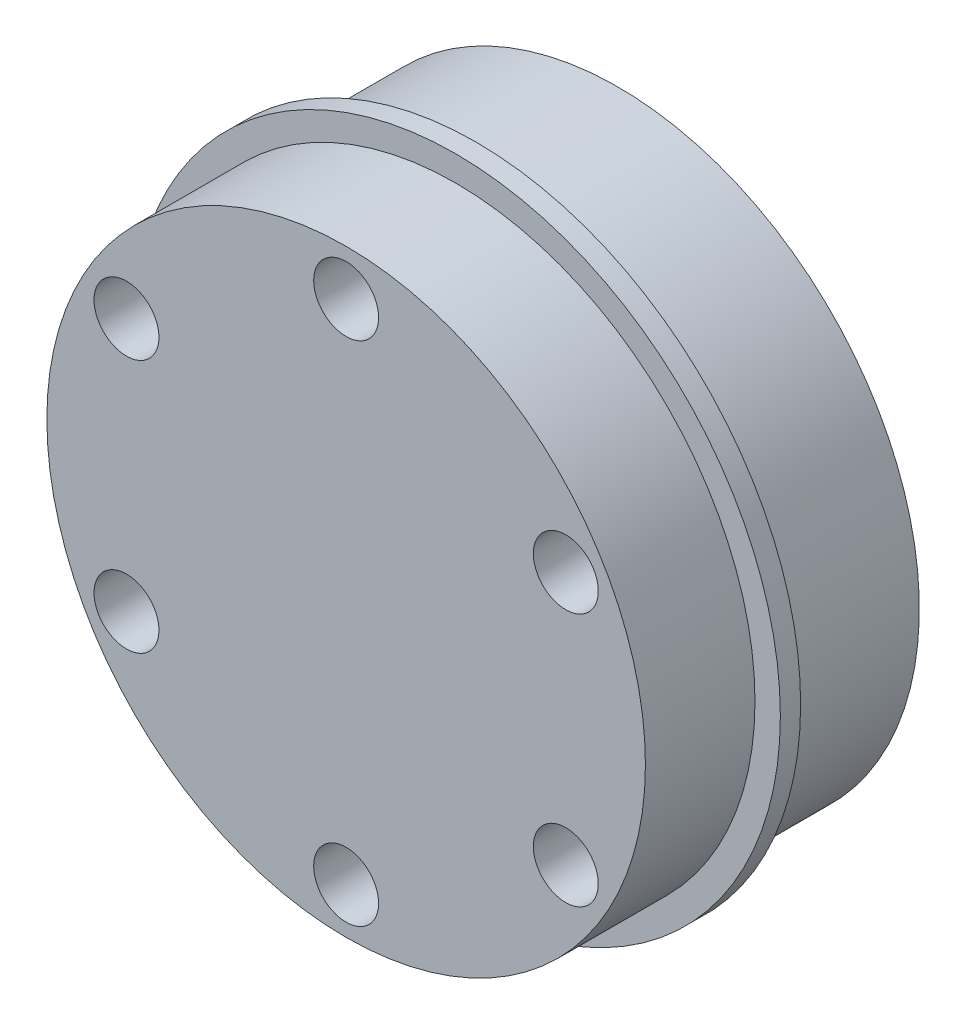
from build123d import *

# Parameters (mm, degrees)
SKETCH_1_R          = 14.75
EXTRUDE_1_DEPTH     = 5.4
SKETCH_3_R          = 16
EXTRUDE_2_DEPTH     = 1
SKETCH_4_R          = 14.85
EXTRUDE_3_DEPTH     = 7
SKETCH_2_R          = 1.6
CUT_EXTRUDE_2_DEPTH = 27.297528401


with BuildPart() as part:
    # 草图1 → 凸台-拉伸1 (new body)
    with BuildSketch(Plane.XY):
        with Locations(Location((0, 0, 0), (0, 0, 180))):
            Circle(SKETCH_1_R)
    extrude(amount=EXTRUDE_1_DEPTH)

    # 草图3 → 凸台-拉伸2 (add)
    with BuildSketch(Plane(origin=(0, 0, 0), x_dir=(-1, 0, 0), z_dir=(0, 0, -1))):
        Circle(SKETCH_3_R)
    extrude(amount=EXTRUDE_2_DEPTH)

    # 草图4 → 凸台-拉伸3 (add)
    with BuildSketch(Plane(origin=(0, 0, -1), x_dir=(-1, 0, 0), z_dir=(0, 0, -1))):
        Circle(SKETCH_4_R)
    extrude(amount=EXTRUDE_3_DEPTH)

    # 草图2 → 切除-拉伸2 (cut, through all)
    with BuildSketch(Plane(origin=(0, 0, 5.4), x_dir=(-1, 0, 0), z_dir=(0, 0, -1))):
        with Locations((10.825317547, -6.25)):
            Circle(SKETCH_2_R)
        with Locations((-10.825317547, 6.25)):
            Circle(SKETCH_2_R)
        with Locations((-10.825317547, -6.25)):
            Circle(SKETCH_2_R)
        with Locations((0, -12.5)):
            Circle(SKETCH_2_R)
        with Locations((10.825317547, 6.25)):
            Circle(SKETCH_2_R)
        with Locations((0, 12.5)):
            Circle(SKETCH_2_R)
    extrude(amount=CUT_EXTRUDE_2_DEPTH, mode=Mode.SUBTRACT)


solid = part.part
